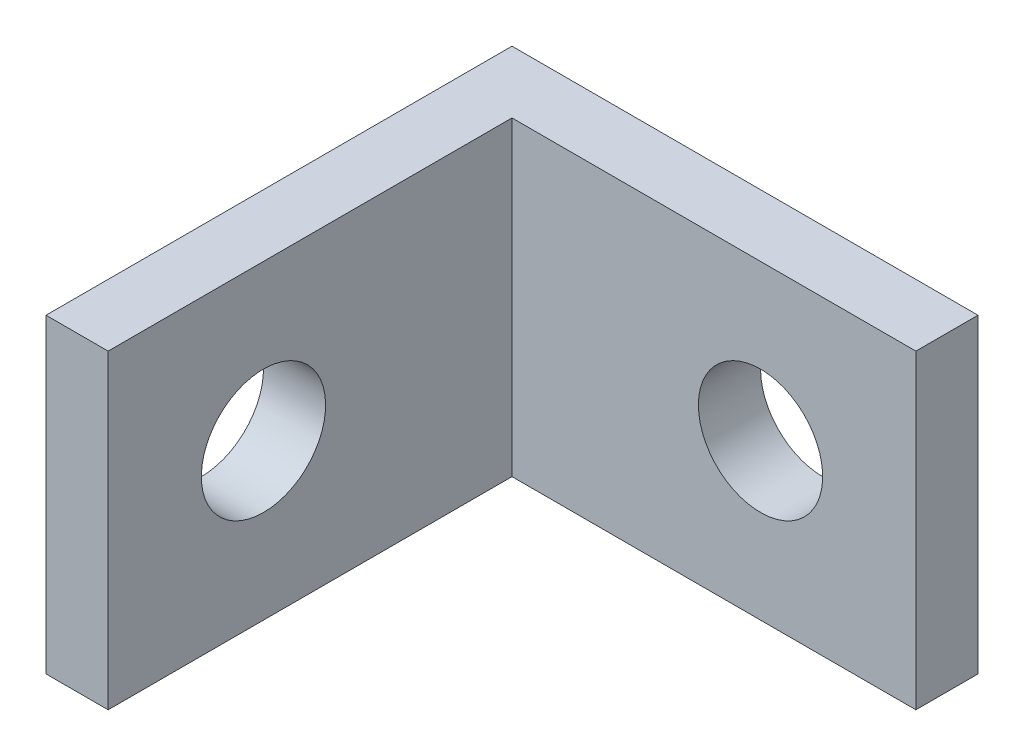
from build123d import *

# Parameters (mm, degrees)
SKETCH1_W           = 15
SKETCH1_H           = 10
BOSS_EXTRUDE1_DEPTH = 2
SKETCH2_W           = 2
SKETCH2_H           = 10
BOSS_EXTRUDE2_DEPTH = 13
SKETCH3_R           = 2
CUT_EXTRUDE1_DEPTH  = 13
SKETCH4_R           = 2
CUT_EXTRUDE2_DEPTH  = 13


with BuildPart() as part:
    # Sketch1 → Boss-Extrude1 (new body)
    with BuildSketch(Plane.XY):
        Rectangle(SKETCH1_W, SKETCH1_H)
    extrude(amount=BOSS_EXTRUDE1_DEPTH)

    # Sketch2 → Boss-Extrude2 (add)
    with BuildSketch(Plane.XY.offset(2)):
        with Locations((-6.5, 0)):
            Rectangle(SKETCH2_W, SKETCH2_H)
    extrude(amount=BOSS_EXTRUDE2_DEPTH)

    # Sketch3 → Cut-Extrude1 (cut)
    with BuildSketch(Plane(origin=(0, 0, 0), x_dir=(-1, 0, 0), z_dir=(0, 0, -1))):
        with Locations((-2.5, 0)):
            Circle(SKETCH3_R)
    extrude(amount=-CUT_EXTRUDE1_DEPTH, mode=Mode.SUBTRACT)

    # Sketch4 → Cut-Extrude2 (cut)
    with BuildSketch(Plane.ZY.offset(7.5)):
        with Locations(Location((10, 0, 0), (0, 0, 270))):
            Circle(SKETCH4_R)
    extrude(amount=-CUT_EXTRUDE2_DEPTH, mode=Mode.SUBTRACT)


solid = part.part
